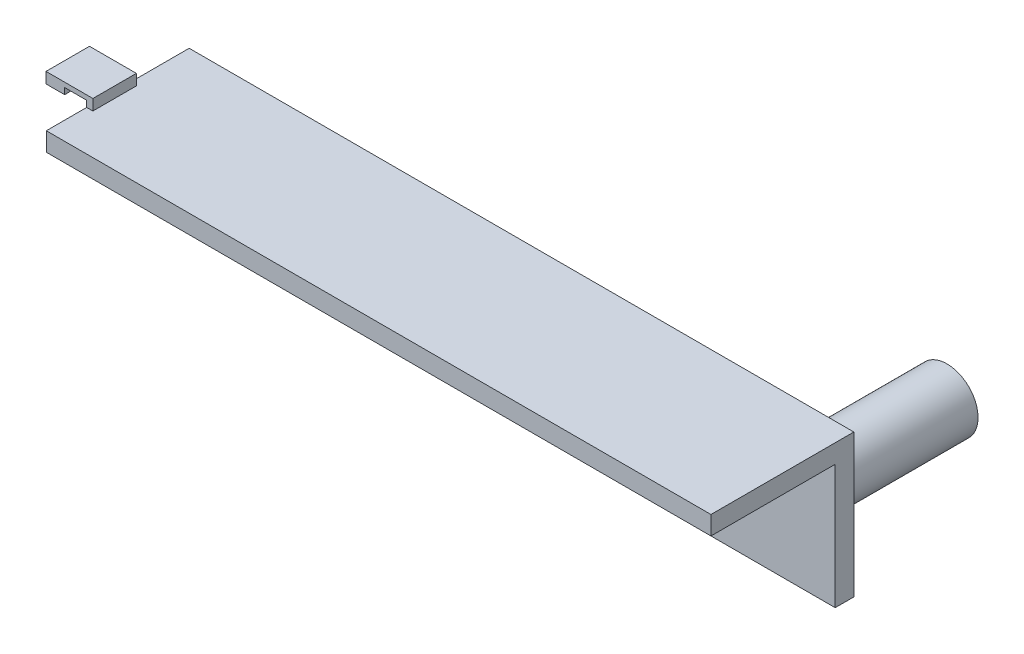
from build123d import *

# Parameters (mm, degrees)
SKETCH1_W                = 20
SKETCH1_H                = 23
BOSS_EXTRUDE1_DEPTH      = 3
SKETCH2_W                = 20
SKETCH2_H                = 3
BOSS_EXTRUDE2_DEPTH      = 20
SKETCH3_R                = 5
BOSS_EXTRUDE3_DEPTH      = 25
SKETCH4_R                = 3
CUT_EXTRUDE1_DEPTH       = 25
SKETCH5_W                = 23
SKETCH5_H                = 3
BOSS_EXTRUDE4_DEPTH      = 87
BOSS_EXTRUDE5_DEPTH      = 5
BOSS_EXTRUDE5_DEPTH_BACK = 2
BOSS_EXTRUDE5_START      = 11.5


with BuildPart() as part:
    # Sketch1 → Boss-Extrude1 (new body)
    with BuildSketch(Plane.XY):
        with Locations((10, -11.5)):
            Rectangle(SKETCH1_W, SKETCH1_H)
    extrude(amount=BOSS_EXTRUDE1_DEPTH)

    # Sketch2 → Boss-Extrude2 (add)
    with BuildSketch(Plane.XY.offset(3)):
        with Locations((10, -1.5)):
            Rectangle(SKETCH2_W, SKETCH2_H)
    extrude(amount=BOSS_EXTRUDE2_DEPTH)

    # Sketch3 → Boss-Extrude3 (add)
    with BuildSketch(Plane(origin=(0, 0, 0), x_dir=(-1, 0, 0), z_dir=(0, 0, -1))):
        with Locations((-10, -13)):
            Circle(SKETCH3_R)
    extrude(amount=BOSS_EXTRUDE3_DEPTH)

    # Sketch4 → Cut-Extrude1 (cut)
    with BuildSketch(Plane(origin=(0, 0, -25), x_dir=(-1, 0, 0), z_dir=(0, 0, -1))):
        with Locations((-10, -13)):
            Circle(SKETCH4_R)
    extrude(amount=-CUT_EXTRUDE1_DEPTH, mode=Mode.SUBTRACT)

    # Sketch5 → Boss-Extrude4 (add)
    with BuildSketch(Plane.ZY):
        with Locations((11.5, -1.5)):
            Rectangle(SKETCH5_W, SKETCH5_H)
    extrude(amount=BOSS_EXTRUDE4_DEPTH)

    # Sketch8 → Boss-Extrude5 (add, two sides: drawn at the far end of the back side and taken through both)
    with BuildSketch(Plane.XY.offset(BOSS_EXTRUDE5_START - BOSS_EXTRUDE5_DEPTH_BACK)):
        Polygon((-87, 0), (-87, 1), (-90.55, 1), (-90.55, 0), (-93.55, 0), (-93.55, 1.75), (-90.55, 1.75), (-86, 1.75), (-86, 0), align=None)
    extrude(amount=BOSS_EXTRUDE5_DEPTH + BOSS_EXTRUDE5_DEPTH_BACK)


solid = part.part
